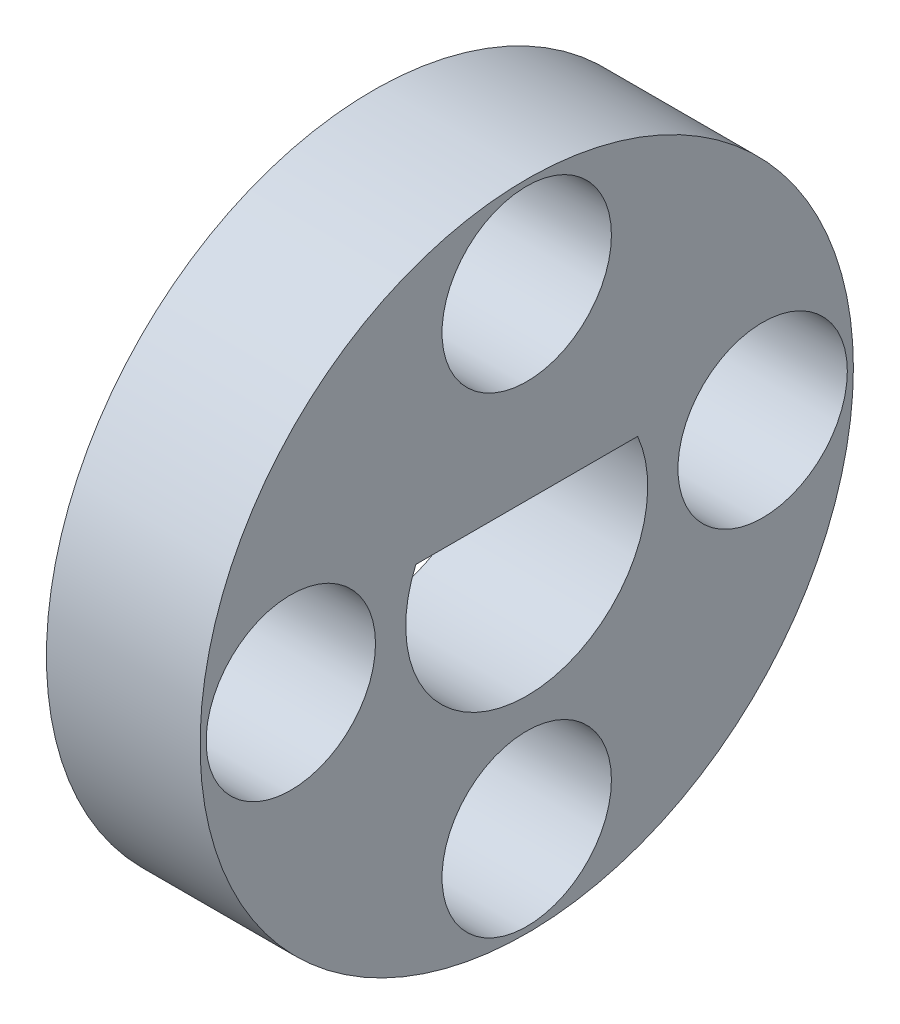
from build123d import *

# Parameters (mm, degrees)
SKETCH1_R           = 13.5
SKETCH1_R_2         = 3.5
BOSS_EXTRUDE1_DEPTH = 6.35


with BuildPart() as part:
    # Sketch1 → Boss-Extrude1 (new body)
    with BuildSketch(Plane(origin=(0, 0, 0), x_dir=(0, 0, -1), z_dir=(1, 0, 0))):
        Circle(SKETCH1_R)
        with Locations((-9.75, 0)):
            Circle(SKETCH1_R_2, mode=Mode.SUBTRACT)
        with Locations((0, 9.75)):
            Circle(SKETCH1_R_2, mode=Mode.SUBTRACT)
        with Locations((9.75, 0)):
            Circle(SKETCH1_R_2, mode=Mode.SUBTRACT)
        with Locations((0, -9.75)):
            Circle(SKETCH1_R_2, mode=Mode.SUBTRACT)
        with BuildLine():
            Line((4.582575695, 2), (-4.582575695, 2))
            ThreePointArc((-4.582575695, 2), (0, -5), (4.582575695, 2))
        make_face(mode=Mode.SUBTRACT)
    extrude(amount=BOSS_EXTRUDE1_DEPTH)


solid = part.part
